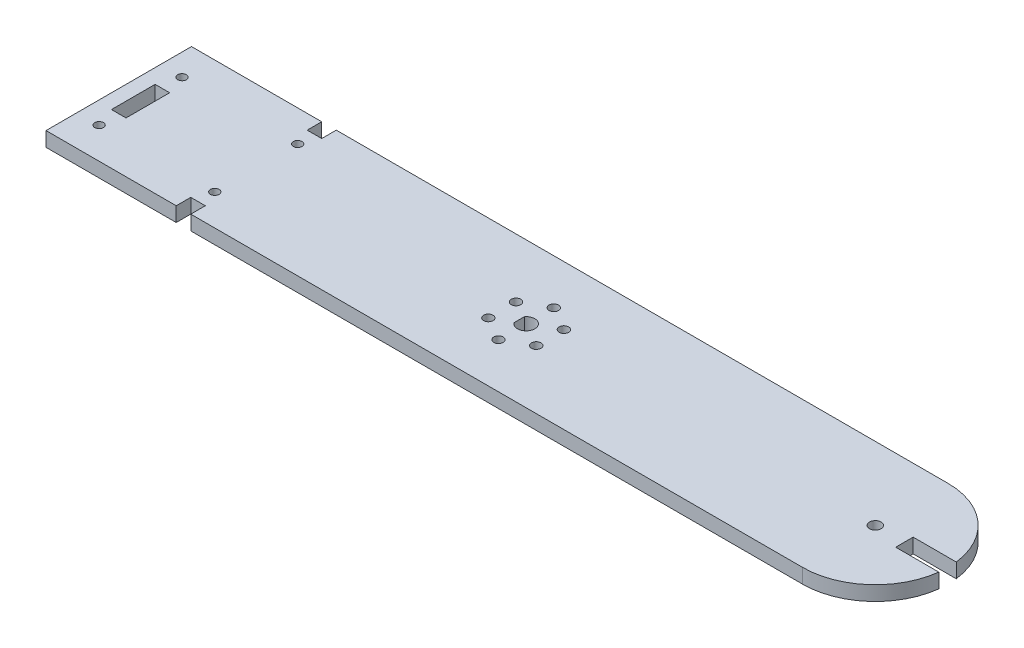
from build123d import *

# Parameters (mm, degrees)
CROQUIS1_R              = 1.5
CROQUIS1_R_2            = 1.63
CROQUIS1_R_3            = 2
CROQUIS1_W              = 5
CROQUIS1_H              = 15
SALIENTE_EXTRUIR1_DEPTH = 5


with BuildPart() as part:
    # Croquis1 → Saliente-Extruir1 (new body)
    with BuildSketch(Plane(origin=(0, 0, 0), x_dir=(1, 0, 0), z_dir=(0, 1, 0))):
        with BuildLine():
            Line((0, 0), (44.75, 0))
            Line((44.75, 0), (44.75, 5))
            Line((44.75, 5), (49.75, 5))
            Line((49.75, 5), (49.75, 0))
            Line((49.75, 0), (260, 0))
            ThreePointArc((260, 0), (276.583123952, 6.291713066), (284.819347292, 22))
            Line((284.819347292, 22), (270, 22))
            Line((270, 22), (270, 28))
            Line((270, 28), (284.819347292, 28))
            ThreePointArc((284.819347292, 28), (276.583123952, 43.708286934), (260, 50))
            Line((260, 50), (49.75, 50))
            Line((49.75, 50), (49.75, 45))
            Line((49.75, 45), (44.75, 45))
            Line((44.75, 45), (44.75, 50))
            Line((44.75, 50), (0, 50))
            Line((0, 50), (0, 0))
        make_face()
        with Locations(Location((47.25, 39.25, 0), (0, 0, 270))):
            Circle(CROQUIS1_R, mode=Mode.SUBTRACT)
        with Locations(Location((140, 34.5, 0), (0, 0, 270))):
            Circle(CROQUIS1_R_2, mode=Mode.SUBTRACT)
        with Locations(Location((47.25, 10.75, 0), (0, 0, 90))):
            Circle(CROQUIS1_R, mode=Mode.SUBTRACT)
        with Locations(Location((7.5, 10.75, 0), (0, 0, 270))):
            Circle(CROQUIS1_R, mode=Mode.SUBTRACT)
        with Locations(Location((7.5, 39.25, 0), (0, 0, 90))):
            Circle(CROQUIS1_R, mode=Mode.SUBTRACT)
        with Locations(Location((131.772758664, 29.75, 0), (0, 0, 270))):
            Circle(CROQUIS1_R_2, mode=Mode.SUBTRACT)
        with Locations(Location((131.772758664, 20.25, 0), (0, 0, 270))):
            Circle(CROQUIS1_R_2, mode=Mode.SUBTRACT)
        with Locations(Location((140, 15.5, 0), (0, 0, 270))):
            Circle(CROQUIS1_R_2, mode=Mode.SUBTRACT)
        with Locations(Location((148.227241336, 20.25, 0), (0, 0, 270))):
            Circle(CROQUIS1_R_2, mode=Mode.SUBTRACT)
        with Locations(Location((148.227241336, 29.75, 0), (0, 0, 270))):
            Circle(CROQUIS1_R_2, mode=Mode.SUBTRACT)
        with Locations(Location((260, 25, 0), (0, 0, 270))):
            Circle(CROQUIS1_R_3, mode=Mode.SUBTRACT)
        with Locations((7.5, 25)):
            Rectangle(CROQUIS1_W, CROQUIS1_H, mode=Mode.SUBTRACT)
        with BuildLine():
            Line((137.6, 23.2), (137.6, 26.8))
            ThreePointArc((137.6, 26.8), (143, 25), (137.6, 23.2))
        make_face(mode=Mode.SUBTRACT)
    extrude(amount=SALIENTE_EXTRUIR1_DEPTH)


solid = part.part
